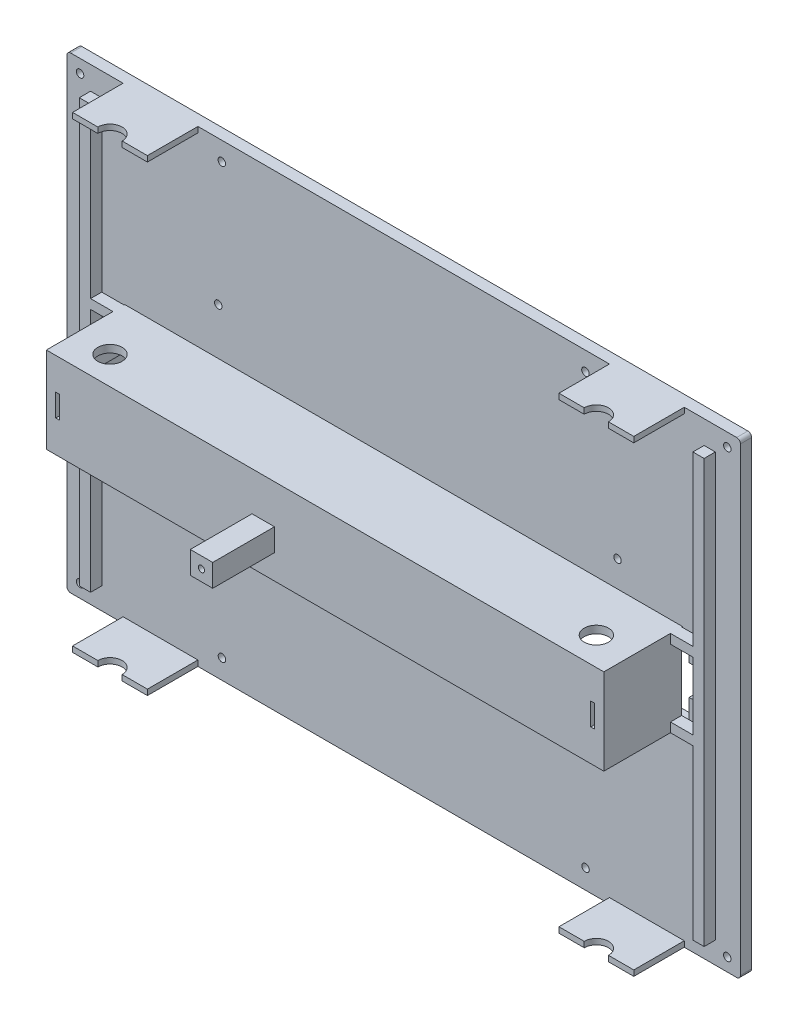
from build123d import *

# Parameters (mm, degrees)
SKETCH_1_W            = 180
SKETCH_1_H            = 125
EXTRUDE_1_DEPTH       = 3
CUT_EXTRUDE_3_REACH   = 111.614
SKETCH_7_W            = 144
SKETCH_7_H            = 21
SKETCH_8_W            = 149
SKETCH_8_H            = 23
SKETCH_8_W_2          = 144
SKETCH_8_H_2          = 19
EXTRUDE_2_DEPTH       = 21
SKETCH_9_W            = 149
SKETCH_9_H            = 23
EXTRUDE_3_DEPTH       = 2
CUT_EXTRUDE_START     = -1.5
SKETCH_4_W            = 2.5
SKETCH_4_H            = 8
CUT_EXTRUDE_2_DEPTH   = 2
SKETCH_10_W           = 6
SKETCH_10_H           = 6
SKETCH_10_R           = 0.825
EXTRUDE_4_DEPTH       = 16.5
CUT_EXTRUDE_3_2_REACH = 118.818
SKETCH_11_R           = 1
SKETCH_12_R           = 2
CUT_EXTRUDE_4_DEPTH   = 1.2
FILLET_1_R            = 1
CUT_EXTRUDE_3_3_REACH = 114.171
SKETCH_13_W           = 1
SKETCH_13_H           = 6
SKETCH_14_W           = 2
SKETCH_14_H           = 5
SKETCH_14_H_2         = 4.5
EXTRUDE_5_DEPTH       = 16
CUT_EXTRUDE_6_DEPTH   = 3.2
SKETCH_17_W           = 2.5
SKETCH_17_H           = 8
CUT_EXTRUDE_7_DEPTH   = 1.5
FILLET_2_R            = 0.25
EXTRUDE_START         = 0.2
EXTRUDE_6_DEPTH       = 3
SKETCH_19_W           = 20
SKETCH_19_H           = 1.5
EXTRUDE_7_DEPTH       = 13.5
CUT_EXTRUDE_START_2   = -125
SKETCH_20_R           = 3.25
CUT_EXTRUDE_8_DEPTH   = 125


with BuildPart() as part:
    # 草图1 → 凸台-拉伸1 (new body)
    with BuildSketch(Plane.XY):
        Rectangle(SKETCH_1_W, SKETCH_1_H)
    extrude(amount=EXTRUDE_1_DEPTH)

    # 草图7 → Cut-Extrude 3 (cut, up to next)
    with BuildSketch(Plane(origin=(0, 0, 0), x_dir=(-1, 0, 0), z_dir=(0, 0, -1)), mode=Mode.PRIVATE) as cut_extrude_3_sk1:
        Rectangle(SKETCH_7_W, SKETCH_7_H)
    cut_extrude_3_tool1 = extrude(cut_extrude_3_sk1.sketch, amount=-CUT_EXTRUDE_3_REACH, mode=Mode.PRIVATE) & part.part
    add(cut_extrude_3_tool1.solids().sort_by_distance((0, 0, 0))[0], mode=Mode.SUBTRACT)

    # 草图8 → 凸台-拉伸2 (add)
    with BuildSketch(Plane.XY.offset(3)):
        Rectangle(SKETCH_8_W, SKETCH_8_H)
        Rectangle(SKETCH_8_W_2, SKETCH_8_H_2, mode=Mode.SUBTRACT)
    extrude(amount=EXTRUDE_2_DEPTH)

    # 草图9 → 凸台-拉伸3 (add)
    with BuildSketch(Plane.XY.offset(24)):
        Rectangle(SKETCH_9_W, SKETCH_9_H)
    extrude(amount=-EXTRUDE_3_DEPTH)

    # 草图4 → 切除-拉伸2 (cut)
    with BuildSketch(Plane(origin=(0, 0, 0), x_dir=(-1, 0, 0), z_dir=(0, 0, -1)).offset(CUT_EXTRUDE_START)):
        with Locations((73.25, 0)):
            Rectangle(SKETCH_4_W, SKETCH_4_H)
    extrude(amount=-CUT_EXTRUDE_2_DEPTH, mode=Mode.SUBTRACT)

    # 草图10 → 凸台-拉伸4 (add)
    with BuildSketch(Plane.XY.offset(24)):
        with Locations((-16.536644653, -1.934734569)):
            Rectangle(SKETCH_10_W, SKETCH_10_H)
        with Locations(Location((-16.536644653, -1.934734569, 0), (0, 0, 180))):
            Circle(SKETCH_10_R, mode=Mode.SUBTRACT)
    extrude(amount=EXTRUDE_4_DEPTH)

    # 草图11 → Cut-Extrude 3 2 (cut, up to next)
    with BuildSketch(Plane(origin=(0, 0, 0), x_dir=(-1, 0, 0), z_dir=(0, 0, -1)), mode=Mode.PRIVATE) as cut_extrude_3_2_sk1:
        with Locations((86.5, 59)):
            Circle(SKETCH_11_R)
    cut_extrude_3_2_tool1 = extrude(cut_extrude_3_2_sk1.sketch, amount=-CUT_EXTRUDE_3_2_REACH, mode=Mode.PRIVATE) & part.part
    # 草图11 → Cut-Extrude 3 2 (cut, up to next)
    with BuildSketch(Plane(origin=(0, 0, 0), x_dir=(-1, 0, 0), z_dir=(0, 0, -1)), mode=Mode.PRIVATE) as cut_extrude_3_2_sk2:
        with Locations((-48.614736579, -57.3)):
            Circle(SKETCH_11_R)
    cut_extrude_3_2_tool2 = extrude(cut_extrude_3_2_sk2.sketch, amount=-CUT_EXTRUDE_3_2_REACH, mode=Mode.PRIVATE) & part.part
    # 草图11 → Cut-Extrude 3 2 (cut, up to next)
    with BuildSketch(Plane(origin=(0, 0, 0), x_dir=(-1, 0, 0), z_dir=(0, 0, -1)), mode=Mode.PRIVATE) as cut_extrude_3_2_sk3:
        with Locations((-49.55, -23.8)):
            Circle(SKETCH_11_R)
    cut_extrude_3_2_tool3 = extrude(cut_extrude_3_2_sk3.sketch, amount=-CUT_EXTRUDE_3_2_REACH, mode=Mode.PRIVATE) & part.part
    # 草图11 → Cut-Extrude 3 2 (cut, up to next)
    with BuildSketch(Plane(origin=(0, 0, 0), x_dir=(-1, 0, 0), z_dir=(0, 0, -1)), mode=Mode.PRIVATE) as cut_extrude_3_2_sk4:
        with Locations((57.15, -18.3)):
            Circle(SKETCH_11_R)
    cut_extrude_3_2_tool4 = extrude(cut_extrude_3_2_sk4.sketch, amount=-CUT_EXTRUDE_3_2_REACH, mode=Mode.PRIVATE) & part.part
    # 草图11 → Cut-Extrude 3 2 (cut, up to next)
    with BuildSketch(Plane(origin=(0, 0, 0), x_dir=(-1, 0, 0), z_dir=(0, 0, -1)), mode=Mode.PRIVATE) as cut_extrude_3_2_sk5:
        with Locations((48.574736579, -57.3)):
            Circle(SKETCH_11_R)
    cut_extrude_3_2_tool5 = extrude(cut_extrude_3_2_sk5.sketch, amount=-CUT_EXTRUDE_3_2_REACH, mode=Mode.PRIVATE) & part.part
    # 草图11 → Cut-Extrude 3 2 (cut, up to next)
    with BuildSketch(Plane(origin=(0, 0, 0), x_dir=(-1, 0, 0), z_dir=(0, 0, -1)), mode=Mode.PRIVATE) as cut_extrude_3_2_sk6:
        with Locations((48.614736579, 57.5)):
            Circle(SKETCH_11_R)
    cut_extrude_3_2_tool6 = extrude(cut_extrude_3_2_sk6.sketch, amount=-CUT_EXTRUDE_3_2_REACH, mode=Mode.PRIVATE) & part.part
    # 草图11 → Cut-Extrude 3 2 (cut, up to next)
    with BuildSketch(Plane(origin=(0, 0, 0), x_dir=(-1, 0, 0), z_dir=(0, 0, -1)), mode=Mode.PRIVATE) as cut_extrude_3_2_sk7:
        with Locations((-57.15, 18.5)):
            Circle(SKETCH_11_R)
    cut_extrude_3_2_tool7 = extrude(cut_extrude_3_2_sk7.sketch, amount=-CUT_EXTRUDE_3_2_REACH, mode=Mode.PRIVATE) & part.part
    # 草图11 → Cut-Extrude 3 2 (cut, up to next)
    with BuildSketch(Plane(origin=(0, 0, 0), x_dir=(-1, 0, 0), z_dir=(0, 0, -1)), mode=Mode.PRIVATE) as cut_extrude_3_2_sk8:
        with Locations((-48.574736579, 57.5)):
            Circle(SKETCH_11_R)
    cut_extrude_3_2_tool8 = extrude(cut_extrude_3_2_sk8.sketch, amount=-CUT_EXTRUDE_3_2_REACH, mode=Mode.PRIVATE) & part.part
    # 草图11 → Cut-Extrude 3 2 (cut, up to next)
    with BuildSketch(Plane(origin=(0, 0, 0), x_dir=(-1, 0, 0), z_dir=(0, 0, -1)), mode=Mode.PRIVATE) as cut_extrude_3_2_sk9:
        with Locations((49.55, 24)):
            Circle(SKETCH_11_R)
    cut_extrude_3_2_tool9 = extrude(cut_extrude_3_2_sk9.sketch, amount=-CUT_EXTRUDE_3_2_REACH, mode=Mode.PRIVATE) & part.part
    # 草图11 → Cut-Extrude 3 2 (cut, up to next)
    with BuildSketch(Plane(origin=(0, 0, 0), x_dir=(-1, 0, 0), z_dir=(0, 0, -1)), mode=Mode.PRIVATE) as cut_extrude_3_2_sk10:
        with Locations((86.5, -59)):
            Circle(SKETCH_11_R)
    cut_extrude_3_2_tool10 = extrude(cut_extrude_3_2_sk10.sketch, amount=-CUT_EXTRUDE_3_2_REACH, mode=Mode.PRIVATE) & part.part
    # 草图11 → Cut-Extrude 3 2 (cut, up to next)
    with BuildSketch(Plane(origin=(0, 0, 0), x_dir=(-1, 0, 0), z_dir=(0, 0, -1)), mode=Mode.PRIVATE) as cut_extrude_3_2_sk11:
        with Locations((-86.5, -59)):
            Circle(SKETCH_11_R)
    cut_extrude_3_2_tool11 = extrude(cut_extrude_3_2_sk11.sketch, amount=-CUT_EXTRUDE_3_2_REACH, mode=Mode.PRIVATE) & part.part
    # 草图11 → Cut-Extrude 3 2 (cut, up to next)
    with BuildSketch(Plane(origin=(0, 0, 0), x_dir=(-1, 0, 0), z_dir=(0, 0, -1)), mode=Mode.PRIVATE) as cut_extrude_3_2_sk12:
        with Locations((-86.5, 59)):
            Circle(SKETCH_11_R)
    cut_extrude_3_2_tool12 = extrude(cut_extrude_3_2_sk12.sketch, amount=-CUT_EXTRUDE_3_2_REACH, mode=Mode.PRIVATE) & part.part
    add(cut_extrude_3_2_tool1.solids().sort_by_distance((-86.5, 59, 0))[0], mode=Mode.SUBTRACT)
    add(cut_extrude_3_2_tool2.solids().sort_by_distance((48.614737, -57.3, 0))[0], mode=Mode.SUBTRACT)
    add(cut_extrude_3_2_tool3.solids().sort_by_distance((49.55, -23.8, 0))[0], mode=Mode.SUBTRACT)
    add(cut_extrude_3_2_tool4.solids().sort_by_distance((-57.15, -18.3, 0))[0], mode=Mode.SUBTRACT)
    add(cut_extrude_3_2_tool5.solids().sort_by_distance((-48.574737, -57.3, 0))[0], mode=Mode.SUBTRACT)
    add(cut_extrude_3_2_tool6.solids().sort_by_distance((-48.614737, 57.5, 0))[0], mode=Mode.SUBTRACT)
    add(cut_extrude_3_2_tool7.solids().sort_by_distance((57.15, 18.5, 0))[0], mode=Mode.SUBTRACT)
    add(cut_extrude_3_2_tool8.solids().sort_by_distance((48.574737, 57.5, 0))[0], mode=Mode.SUBTRACT)
    add(cut_extrude_3_2_tool9.solids().sort_by_distance((-49.55, 24, 0))[0], mode=Mode.SUBTRACT)
    add(cut_extrude_3_2_tool10.solids().sort_by_distance((-86.5, -59, 0))[0], mode=Mode.SUBTRACT)
    add(cut_extrude_3_2_tool11.solids().sort_by_distance((86.5, -59, 0))[0], mode=Mode.SUBTRACT)
    add(cut_extrude_3_2_tool12.solids().sort_by_distance((86.5, 59, 0))[0], mode=Mode.SUBTRACT)

    # 草图12 → 固定螺丝凹陷切除-拉伸4 (cut)
    with BuildSketch(Plane(origin=(0, 0, 0), x_dir=(-1, 0, 0), z_dir=(0, 0, -1))):
        with Locations((-48.574736579, 57.5)):
            Circle(SKETCH_12_R)
        with Locations((-57.15, 18.5)):
            Circle(SKETCH_12_R)
        with Locations((-49.55, -23.8)):
            Circle(SKETCH_12_R)
        with Locations((-48.614736579, -57.3)):
            Circle(SKETCH_12_R)
        with Locations((48.574736579, -57.3)):
            Circle(SKETCH_12_R)
        with Locations((57.15, -18.3)):
            Circle(SKETCH_12_R)
        with Locations((-86.5, 59)):
            Circle(SKETCH_12_R)
        with Locations((48.614736579, 57.5)):
            Circle(SKETCH_12_R)
        with Locations((49.55, 24)):
            Circle(SKETCH_12_R)
        with Locations((-86.5, -59)):
            Circle(SKETCH_12_R)
        with Locations((86.5, -59)):
            Circle(SKETCH_12_R)
        with Locations((86.5, 59)):
            Circle(SKETCH_12_R)
    extrude(amount=-CUT_EXTRUDE_4_DEPTH, mode=Mode.SUBTRACT)

    # 圆角1
    fillet_1_edges = [part.edges().sort_by_distance(p)[0] for p in [
        (90, -62.5, 1.5),
        (-90, -62.5, 1.5),
        (-90, 62.5, 1.5),
        (90, 62.5, 1.5),
    ]]
    fillet(fillet_1_edges, radius=FILLET_1_R)

    # 草图13 → Cut-Extrude 3 3 (cut, up to next)
    with BuildSketch(Plane.XY.offset(24), mode=Mode.PRIVATE) as cut_extrude_3_3_sk1:
        with Locations((71.5, 0)):
            Rectangle(SKETCH_13_W, SKETCH_13_H)
    cut_extrude_3_3_tool1 = extrude(cut_extrude_3_3_sk1.sketch, amount=-CUT_EXTRUDE_3_3_REACH, mode=Mode.PRIVATE) & part.part
    # 草图13 → Cut-Extrude 3 3 (cut, up to next)
    with BuildSketch(Plane.XY.offset(24), mode=Mode.PRIVATE) as cut_extrude_3_3_sk2:
        with Locations((-71.5, 0)):
            Rectangle(SKETCH_13_W, SKETCH_13_H)
    cut_extrude_3_3_tool2 = extrude(cut_extrude_3_3_sk2.sketch, amount=-CUT_EXTRUDE_3_3_REACH, mode=Mode.PRIVATE) & part.part
    add(cut_extrude_3_3_tool1.solids().sort_by_distance((71.5, 0, 24))[0], mode=Mode.SUBTRACT)
    add(cut_extrude_3_3_tool2.solids().sort_by_distance((-71.5, 0, 24))[0], mode=Mode.SUBTRACT)

    # 草图14 → 凸台-拉伸5 (add)
    with BuildSketch(Plane(origin=(0, 0, 22), x_dir=(-1, 0, 0), z_dir=(0, 0, -1))):
        with Locations((-70, 8)):
            Rectangle(SKETCH_14_W, SKETCH_14_H)
        with Locations((70, 8.25)):
            Rectangle(SKETCH_14_W, SKETCH_14_H_2)
        with Locations((70, -8.25)):
            Rectangle(SKETCH_14_W, SKETCH_14_H_2)
        with Locations((-70, -8)):
            Rectangle(SKETCH_14_W, SKETCH_14_H)
    extrude(amount=EXTRUDE_5_DEPTH)

    # 草图15 → 切除-拉伸6 (cut)
    with BuildSketch(Plane(origin=(0, 0, 0), x_dir=(-1, 0, 0), z_dir=(0, 0, -1))):
        Polygon((72, 10.5), (72, -10.5), (-76.3, -10.5), (-76.3, -4), (-79.336491673, -4), (-79.336491673, 4), (-76.3, 4), (-76.3, 10.5), align=None)
    extrude(amount=-CUT_EXTRUDE_6_DEPTH, mode=Mode.SUBTRACT)

    # 草图17 → 切除-拉伸7 (cut)
    with BuildSketch(Plane(origin=(0, 0, 0), x_dir=(-1, 0, 0), z_dir=(0, 0, -1))):
        with Locations((-80.586491673, 0)):
            Rectangle(SKETCH_17_W, SKETCH_17_H)
    extrude(amount=-CUT_EXTRUDE_7_DEPTH, mode=Mode.SUBTRACT)

    # 圆角2
    fillet_2_edges = [part.edges().sort_by_distance(p)[0] for p in [
        (70, 9.5, 6),
        (69, 9.5, 14),
        (71, 9.5, 14),
        (69, 7.5, 6),
        (71, 7.5, 6),
        (70, 5.5, 6),
        (-70, 9.5, 6),
        (-71, 9.5, 14),
        (-69, 9.5, 14),
        (-71, 7.75, 6),
        (-69, 7.75, 6),
        (-70, 6, 6),
        (-70, -9.5, 6),
        (-69, -9.5, 14),
        (-71, -9.5, 14),
        (-69, -7.75, 6),
        (-71, -7.75, 6),
        (-70, -6, 6),
        (70, -9.5, 6),
        (71, -9.5, 14),
        (69, -9.5, 14),
        (71, -7.5, 6),
        (69, -7.5, 6),
        (70, -5.5, 6),
        (79.336491673, 0, 3),
        (81.836491673, 0, 0),
    ]]
    fillet(fillet_2_edges, radius=FILLET_2_R)

    # 草图18 → 凸台-拉伸6 (add)
    with BuildSketch(Plane.XY.offset(3).offset(EXTRUDE_START)):
        Polygon((-83.5, 56.5), (-80.5, 56.5), (-80.5, 11.5), (-74.5, 11.5), (-74.5, 9), (-80.5, 9), (-80.5, -9), (-74.5, -9), (-74.5, -11.5), (-80.5, -11.5), (-80.5, -56.5), (-83.5, -56.5), align=None)
        Polygon((80.5, -11.5), (80.5, -56.5), (83.5, -56.5), (83.5, 56.5), (80.5, 56.5), (80.5, 11.5), (74.5, 11.5), (74.5, 9), (80.5, 9), (80.5, -9), (74.5, -9), (74.5, -11.5), align=None)
    extrude(amount=EXTRUDE_6_DEPTH)

    # 草图19 → 凸台-拉伸7 (add)
    with BuildSketch(Plane.XY.offset(3)):
        with Locations((-65, -61.75)):
            Rectangle(SKETCH_19_W, SKETCH_19_H)
        with Locations((65, -61.75)):
            Rectangle(SKETCH_19_W, SKETCH_19_H)
        with Locations((65, 61.75)):
            Rectangle(SKETCH_19_W, SKETCH_19_H)
        with Locations((-65, 61.75)):
            Rectangle(SKETCH_19_W, SKETCH_19_H)
    extrude(amount=EXTRUDE_7_DEPTH)

    # 草图20 → 切除-拉伸8 (cut)
    with BuildSketch(Plane.XZ.offset(62.5).offset(CUT_EXTRUDE_START_2)):
        with Locations(Location((-65, 16.5, 0), (0, 0, 270))):
            Circle(SKETCH_20_R)
        with Locations(Location((65, 16.5, 0), (0, 0, 270))):
            Circle(SKETCH_20_R)
    extrude(amount=CUT_EXTRUDE_8_DEPTH, mode=Mode.SUBTRACT)


solid = part.part
